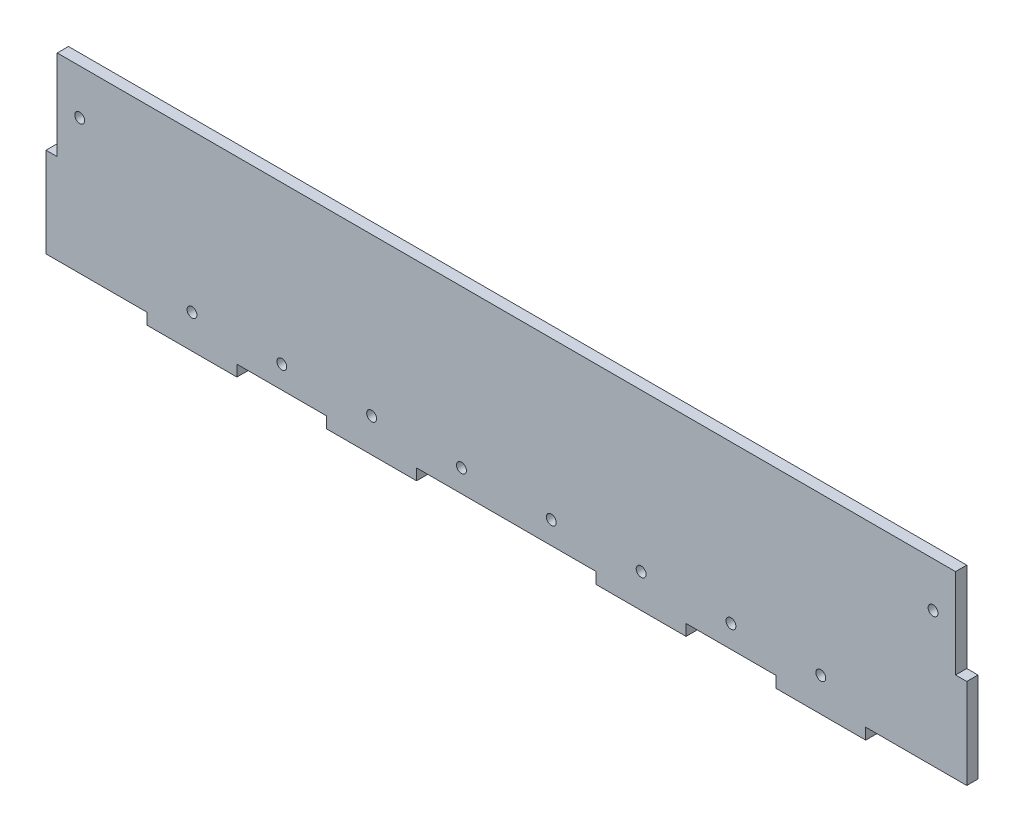
from build123d import *

# Parameters (mm, degrees)
SKETCH_1_R          = 2.2
EXTRUDE_1_DEPTH     = 5
SKETCH_2_W          = 5
SKETCH_2_H          = 220.282443136
SKETCH_2_H_2        = 219.868690955
CUT_EXTRUDE_1_DEPTH = 10
SKETCH_3_W          = 5
SKETCH_3_H          = 40
EXTRUDE_3_DEPTH     = 5
SKETCH_4_W          = 390.4211829
SKETCH_4_H          = 264.690207343
EXTRUDE_4_DEPTH     = 5
SKETCH_5_R          = 2.2
CUT_EXTRUDE_2_DEPTH = 5
SKETCH_6_W          = 410
SKETCH_6_H          = 266.694039068
CUT_EXTRUDE_4_DEPTH = 10


with BuildPart() as part:
    # 草图1 → 凸台-拉伸1 (new body)
    with BuildSketch(Plane.XY):
        Polygon((-200, 150), (200, 150), (200, 110), (205, 110), (205, 70), (200, 70), (200, 30), (205, 30), (205, -30), (200, -30), (200, -70), (205, -70), (205, -110), (200, -110), (200, -150), (160, -150), (160, -155), (120, -155), (120, -150), (80, -150), (80, -155), (40, -155), (40, -150), (-40, -150), (-40, -155), (-80, -155), (-80, -150), (-120, -150), (-120, -155), (-160, -155), (-160, -150), (-200, -150), (-200, -110), (-205, -110), (-205, -70), (-200, -70), (-200, -30), (-205, -30), (-205, 30), (-200, 30), (-200, 70), (-205, 70), (-205, 110), (-200, 110), align=None)
        with Locations((-140, -140)):
            Circle(SKETCH_1_R, mode=Mode.SUBTRACT)
        with Locations((-100, -140)):
            Circle(SKETCH_1_R, mode=Mode.SUBTRACT)
        with Locations((-60, -140)):
            Circle(SKETCH_1_R, mode=Mode.SUBTRACT)
        with Locations((-20, -140)):
            Circle(SKETCH_1_R, mode=Mode.SUBTRACT)
        with Locations((20, -140)):
            Circle(SKETCH_1_R, mode=Mode.SUBTRACT)
        with Locations((60, -140)):
            Circle(SKETCH_1_R, mode=Mode.SUBTRACT)
        with Locations((100, -140)):
            Circle(SKETCH_1_R, mode=Mode.SUBTRACT)
        with Locations((140, -140)):
            Circle(SKETCH_1_R, mode=Mode.SUBTRACT)
        with Locations((-190, 110)):
            Circle(SKETCH_1_R, mode=Mode.SUBTRACT)
        with Locations((-190, 70)):
            Circle(SKETCH_1_R, mode=Mode.SUBTRACT)
        with Locations((-190, 30)):
            Circle(SKETCH_1_R, mode=Mode.SUBTRACT)
        with Locations((-190, -30)):
            Circle(SKETCH_1_R, mode=Mode.SUBTRACT)
        with Locations((-190, -70)):
            Circle(SKETCH_1_R, mode=Mode.SUBTRACT)
        with Locations((-190, -110)):
            Circle(SKETCH_1_R, mode=Mode.SUBTRACT)
        with Locations((190, -110)):
            Circle(SKETCH_1_R, mode=Mode.SUBTRACT)
        with Locations((190, -70)):
            Circle(SKETCH_1_R, mode=Mode.SUBTRACT)
        with Locations((190, -30)):
            Circle(SKETCH_1_R, mode=Mode.SUBTRACT)
        with Locations((190, 30)):
            Circle(SKETCH_1_R, mode=Mode.SUBTRACT)
        with Locations((190, 70)):
            Circle(SKETCH_1_R, mode=Mode.SUBTRACT)
        with Locations((190, 110)):
            Circle(SKETCH_1_R, mode=Mode.SUBTRACT)
    extrude(amount=EXTRUDE_1_DEPTH)

    # 草图2 → 切除-拉伸1 (cut)
    with BuildSketch(Plane.XY.offset(5)):
        with Locations((-202.5, -0.141221568)):
            Rectangle(SKETCH_2_W, SKETCH_2_H)
        with Locations((202.5, 0.065654522)):
            Rectangle(SKETCH_2_W, SKETCH_2_H_2)
    extrude(amount=-CUT_EXTRUDE_1_DEPTH, mode=Mode.SUBTRACT)

    # 草图3 → 凸台-拉伸3 (add)
    with BuildSketch(Plane.XY.offset(5)):
        with Locations((-202.5, 130)):
            Rectangle(SKETCH_3_W, SKETCH_3_H)
        with Locations((-202.5, 50)):
            Rectangle(SKETCH_3_W, SKETCH_3_H)
        with Locations((-202.5, -50)):
            Rectangle(SKETCH_3_W, SKETCH_3_H)
        with Locations((-202.5, -130)):
            Rectangle(SKETCH_3_W, SKETCH_3_H)
        with Locations((202.5, -130)):
            Rectangle(SKETCH_3_W, SKETCH_3_H)
        with Locations((202.5, -50)):
            Rectangle(SKETCH_3_W, SKETCH_3_H)
        with Locations((202.5, 50)):
            Rectangle(SKETCH_3_W, SKETCH_3_H)
        with Locations((202.5, 130)):
            Rectangle(SKETCH_3_W, SKETCH_3_H)
    extrude(amount=-EXTRUDE_3_DEPTH)

    # 草图4 → 凸台-拉伸4 (add)
    with BuildSketch(Plane.XY.offset(5)):
        with Locations((1.806920954, 7.46039962)):
            Rectangle(SKETCH_4_W, SKETCH_4_H)
    extrude(amount=-EXTRUDE_4_DEPTH)

    # 草图5 → 切除-拉伸2 (cut)
    with BuildSketch(Plane.XY.offset(5)):
        with Locations((-190, 90)):
            Circle(SKETCH_5_R)
        with Locations((-190, 50)):
            Circle(SKETCH_5_R)
        with Locations((-190, 0)):
            Circle(SKETCH_5_R)
        with Locations((-190, -50)):
            Circle(SKETCH_5_R)
        with Locations((-190, -90)):
            Circle(SKETCH_5_R)
        with Locations(Location((190, -90, 0), (0, 0, 180))):
            Circle(SKETCH_5_R)
        with Locations(Location((190, -50, 0), (0, 0, 180))):
            Circle(SKETCH_5_R)
        with Locations(Location((190, 0, 0), (0, 0, 180))):
            Circle(SKETCH_5_R)
        with Locations(Location((190, 50, 0), (0, 0, 180))):
            Circle(SKETCH_5_R)
        with Locations(Location((190, 90, 0), (0, 0, 180))):
            Circle(SKETCH_5_R)
    extrude(amount=-CUT_EXTRUDE_2_DEPTH, mode=Mode.SUBTRACT)

    # 草图6 → 切除-拉伸4 (cut)
    with BuildSketch(Plane.XY.offset(5)):
        with Locations((0, 63.347019534)):
            Rectangle(SKETCH_6_W, SKETCH_6_H)
    extrude(amount=-CUT_EXTRUDE_4_DEPTH, mode=Mode.SUBTRACT)


solid = part.part
